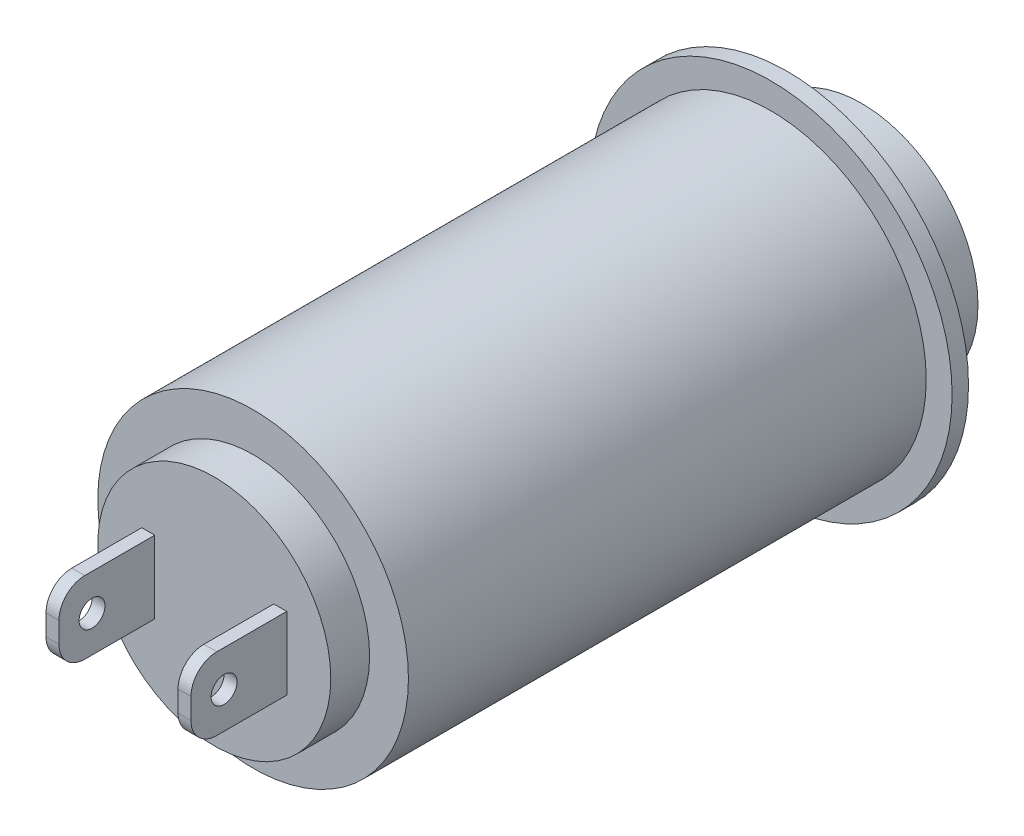
from build123d import *

# Parameters (mm, degrees)
SKETCH_1_R          = 4.5
EXTRUDE_1_DEPTH     = 2
SKETCH_2_R          = 7
EXTRUDE_2_DEPTH     = 1.5
SKETCH_3_R          = 6
EXTRUDE_3_DEPTH     = 20
SKETCH_4_R          = 4.5
EXTRUDE_4_DEPTH     = 1.5
SKETCH_5_W          = 0.5
SKETCH_5_H          = 2.8
EXTRUDE_5_DEPTH     = 3.7
CHAMFER_1_SIZE      = 1.5
CHAMFER_1_SIZE2     = 0.866025404
FILLET_1_R          = 1
SKETCH_6_R          = 0.5
CUT_EXTRUDE_1_DEPTH = 32.124427706


with BuildPart() as part:
    # 스케치1 → 보스-돌출1 (new body)
    with BuildSketch(Plane.XY):
        Circle(SKETCH_1_R)
    extrude(amount=EXTRUDE_1_DEPTH)

    # 스케치2 → 보스-돌출2 (add)
    with BuildSketch(Plane.XY.offset(2)):
        Circle(SKETCH_2_R)
    extrude(amount=EXTRUDE_2_DEPTH)

    # 스케치3 → 보스-돌출3 (add)
    with BuildSketch(Plane.XY.offset(3.5)):
        Circle(SKETCH_3_R)
    extrude(amount=EXTRUDE_3_DEPTH)

    # 스케치4 → 보스-돌출4 (add)
    with BuildSketch(Plane.XY.offset(23.5)):
        Circle(SKETCH_4_R)
    extrude(amount=EXTRUDE_4_DEPTH)

    # 스케치5 → 보스-돌출5 (add)
    with BuildSketch(Plane.XY.offset(25)):
        with Locations((2.55, 0)):
            Rectangle(SKETCH_5_W, SKETCH_5_H)
        with Locations((-2.55, 0)):
            Rectangle(SKETCH_5_W, SKETCH_5_H)
    extrude(amount=EXTRUDE_5_DEPTH)

    # 모따기1
    chamfer_1_edges = [part.edges().sort_by_distance(p)[0] for p in [
        (-7, 0, 2),
    ]]
    chamfer_1_side = [part.faces().sort_by_distance(p)[0] for p in [
        (-6.802010101, 0, 2),
    ]]
    chamfer(chamfer_1_edges, length=CHAMFER_1_SIZE, length2=CHAMFER_1_SIZE2, reference=chamfer_1_side[0])

    # 필렛1
    fillet_1_edges = [part.edges().sort_by_distance(p)[0] for p in [
        (-2.55, 1.4, 28.7),
        (-2.55, -1.4, 28.7),
        (2.55, 1.4, 28.7),
        (2.55, -1.4, 28.7),
    ]]
    fillet(fillet_1_edges, radius=FILLET_1_R)

    # 스케치6 → 컷-돌출1 (cut, through all)
    with BuildSketch(Plane.ZY.offset(2.8)):
        with Locations((27.421769494, 0)):
            Circle(SKETCH_6_R)
    extrude(amount=-CUT_EXTRUDE_1_DEPTH, mode=Mode.SUBTRACT)


solid = part.part
